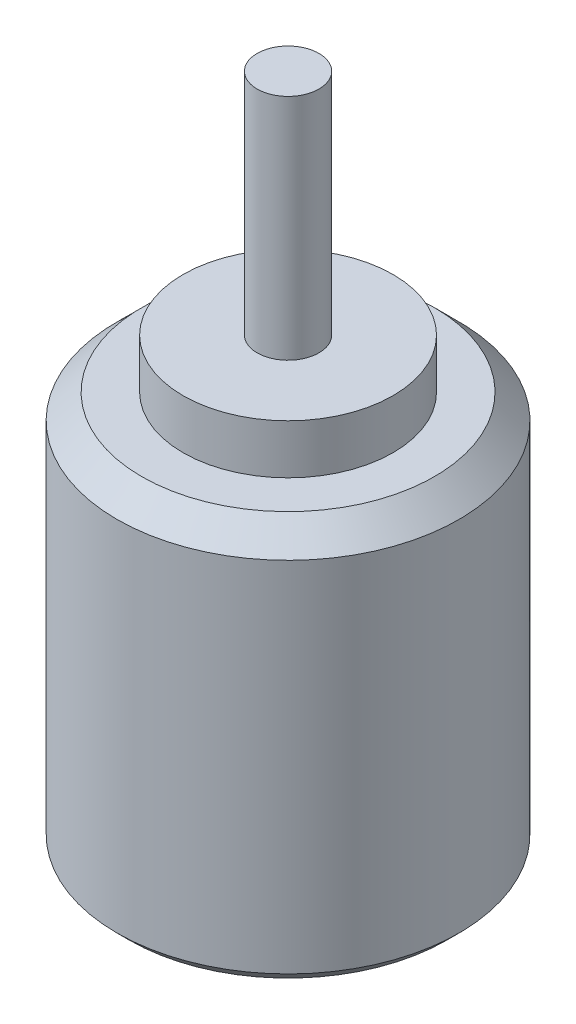
from build123d import *

# Parameters (mm, degrees)
SKETCH_1_R          = 13.85
EXTRUDE_1_DEPTH     = 32
SKETCH_2_R          = 2.5
EXTRUDE_2_DEPTH     = 2.5
SKETCH_3_R          = 8.5
EXTRUDE_3_DEPTH     = 4
EXTRUDE_START       = 18.5
SKETCH_4_R          = 2.5
EXTRUDE_4_DEPTH     = 18.5
CHAMFER_1_SIZE      = 2
CHAMFER_2_SIZE      = 1
SKETCH_5_R          = 1.35
CUT_EXTRUDE_1_DEPTH = 3


with BuildPart() as part:
    # 草图1 → 凸台-拉伸1 (new body)
    with BuildSketch(Plane(origin=(0, 0, 0), x_dir=(1, 0, 0), z_dir=(0, 1, 0))):
        with Locations(Location((0, 0, 0), (0, 0, 270))):
            Circle(SKETCH_1_R)
    extrude(amount=EXTRUDE_1_DEPTH)

    # 草图2 → 凸台-拉伸2 (add)
    with BuildSketch(Plane.XZ):
        with Locations(Location((0, 0, 0), (0, 0, 270))):
            Circle(SKETCH_2_R)
    extrude(amount=EXTRUDE_2_DEPTH)

    # 草图3 → 凸台-拉伸3 (add)
    with BuildSketch(Plane(origin=(0, 32, 0), x_dir=(1, 0, 0), z_dir=(0, 1, 0))):
        with Locations(Location((0, 0, 0), (0, 0, 270))):
            Circle(SKETCH_3_R)
    extrude(amount=EXTRUDE_3_DEPTH)

    # 草图4 → 凸台-拉伸4 (add)
    with BuildSketch(Plane(origin=(0, 36, 0), x_dir=(1, 0, 0), z_dir=(0, 1, 0)).offset(EXTRUDE_START)):
        with Locations(Location((0, 0, 0), (0, 0, 90))):
            Circle(SKETCH_4_R)
    extrude(amount=-EXTRUDE_4_DEPTH)

    # 倒角1
    chamfer_1_edges = [part.edges().sort_by_distance(p)[0] for p in [
        (0, 32, -13.85),
    ]]
    chamfer(chamfer_1_edges, length=CHAMFER_1_SIZE)

    # 倒角2
    chamfer_2_edges = [part.edges().sort_by_distance(p)[0] for p in [
        (0, 0, -13.85),
    ]]
    chamfer(chamfer_2_edges, length=CHAMFER_2_SIZE)

    # 草图5 → 切除-拉伸1 (cut)
    with BuildSketch(Plane.XZ):
        with Locations(Location((0, 7.8, 0), (0, 0, 270))):
            Circle(SKETCH_5_R)
        with Locations(Location((-9.3, 0, 0), (0, 0, 270))):
            Circle(SKETCH_5_R)
        with Locations(Location((0, -7.8, 0), (0, 0, 270))):
            Circle(SKETCH_5_R)
        with Locations(Location((9.3, 0, 0), (0, 0, 270))):
            Circle(SKETCH_5_R)
    extrude(amount=-CUT_EXTRUDE_1_DEPTH, mode=Mode.SUBTRACT)


solid = part.part
